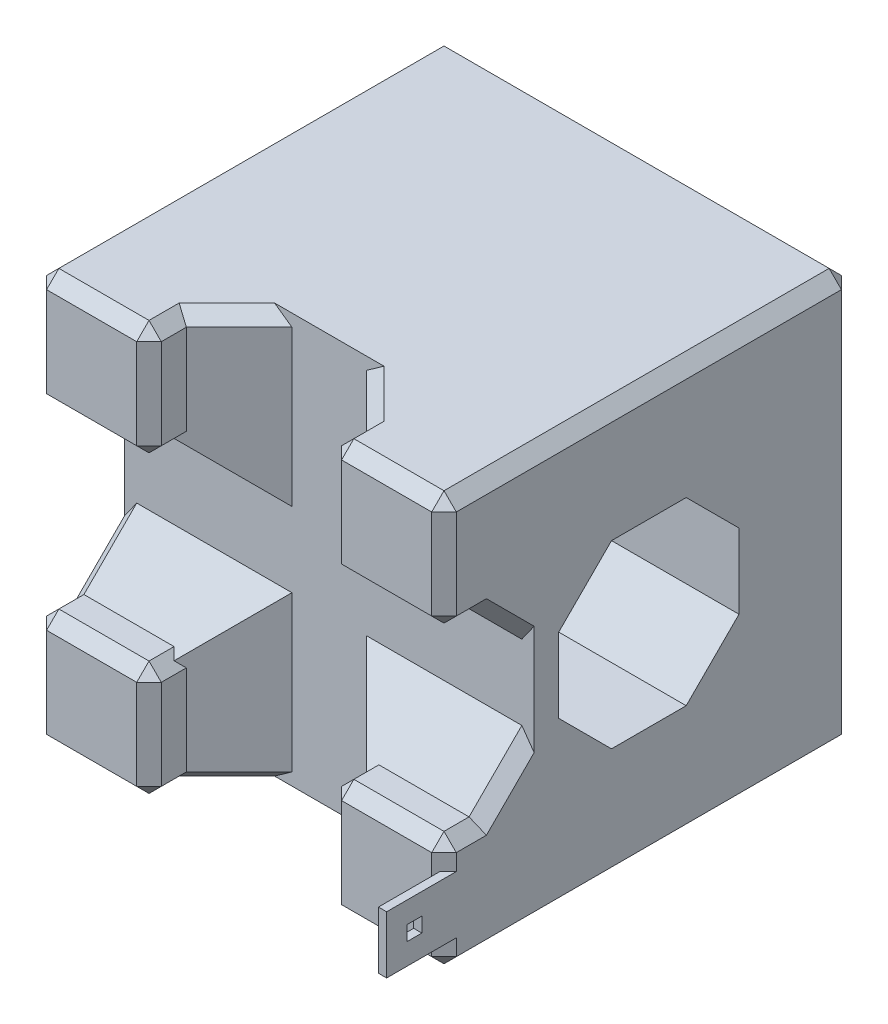
from build123d import *

# Parameters (mm, degrees)
SKETCH1_W                = 50
SKETCH1_H                = 50
BOSS_EXTRUDE1_DEPTH      = 50
CUT_EXTRUDE1_DEPTH       = 87.602540378
CUT_EXTRUDE2_DEPTH       = 87.602540378
CHAMFER1_SIZE            = 1.5
BOSS_EXTRUDE2_DEPTH      = 7
BOSS_EXTRUDE2_DEPTH_BACK = 10
SKETCH4_W                = 1
SKETCH4_H                = 7
SKETCH5_W                = 1.8
SKETCH5_H                = 1.8
CUT_EXTRUDE3_DEPTH       = 7


with BuildPart() as part:
    # Sketch1 → Boss-Extrude1 (new body)
    with BuildSketch(Plane.XY):
        with Locations((25, 25)):
            Rectangle(SKETCH1_W, SKETCH1_H)
    extrude(amount=BOSS_EXTRUDE1_DEPTH)

    # Sketch2 → Cut-Extrude1 (cut, through all)
    with BuildSketch(Plane.ZY):
        Polygon((36, 29.556349186), (29.556349186, 36), (20.443650814, 36), (14, 29.556349186), (14, 20.443650814), (20.443650814, 14), (29.556349186, 14), (36, 20.443650814), align=None)
        Polygon((61, 29.556349186), (54.556349186, 36), (45.443650814, 36), (39, 29.556349186), (39, 20.443650814), (45.443650814, 14), (54.556349186, 14), (61, 20.443650814), align=None)
    extrude(amount=-CUT_EXTRUDE1_DEPTH, mode=Mode.SUBTRACT)

    # Sketch3 → Cut-Extrude2 (cut, through all)
    with BuildSketch(Plane.XZ):
        Polygon((29.556349186, 39), (36, 45.443650814), (36, 54.556349186), (29.556349186, 61), (20.443650814, 61), (14, 54.556349186), (14, 45.443650814), (20.443650814, 39), align=None)
    extrude(amount=-CUT_EXTRUDE2_DEPTH, mode=Mode.SUBTRACT)

    # Chamfer1
    chamfer1_edges = [part.edges().sort_by_distance(p)[0] for p in [
        (50, 7, 50),
        (0, 7, 50),
        (50, 43, 50),
        (7, 36, 50),
        (43, 14, 50),
        (43, 50, 50),
        (50, 14, 47.721825407),
        (50, 36, 47.721825407),
        (0, 14, 47.721825407),
        (0, 36, 47.721825407),
        (0, 32.778174593, 42.221825407),
        (0, 17.221825407, 42.221825407),
        (50, 17.221825407, 42.221825407),
        (50, 32.778174593, 42.221825407),
        (43, 36, 50),
        (36, 36, 47.721825407),
        (14, 36, 47.721825407),
        (7, 14, 50),
        (7, 50, 50),
        (43, 0, 50),
        (36, 0, 47.721825407),
        (14, 0, 47.721825407),
        (17.221825407, 0, 42.221825407),
        (32.778174593, 0, 42.221825407),
        (14, 7, 50),
        (14, 14, 47.721825407),
        (14, 43, 50),
        (14, 50, 47.721825407),
        (36, 14, 47.721825407),
        (36, 7, 50),
        (36, 50, 47.721825407),
        (36, 43, 50),
        (17.221825407, 50, 42.221825407),
        (32.778174593, 50, 42.221825407),
        (0, 43, 50),
        (25, 50, 0),
        (50, 25, 0),
        (25, 0, 0),
        (0, 25, 0),
        (7, 0, 50),
        (0, 50, 25),
        (50, 50, 25),
        (50, 0, 25),
        (0, 0, 25),
    ]]
    chamfer(chamfer1_edges, length=CHAMFER1_SIZE)

    # Sketch4 → Boss-Extrude2 (add, two sides: drawn at the far end of the back side and taken through both)
    with BuildSketch(Plane.XY.offset(50).offset(-BOSS_EXTRUDE2_DEPTH_BACK)):
        with Locations((49.5, 7)):
            Rectangle(SKETCH4_W, SKETCH4_H)
    extrude(amount=BOSS_EXTRUDE2_DEPTH + BOSS_EXTRUDE2_DEPTH_BACK)

    # Sketch5 → Cut-Extrude3 (cut)
    with BuildSketch(Plane(origin=(50, 0, 0), x_dir=(0, 0, -1), z_dir=(1, 0, 0))):
        with Locations((-53.6, 7)):
            Rectangle(SKETCH5_W, SKETCH5_H)
    extrude(amount=-CUT_EXTRUDE3_DEPTH, mode=Mode.SUBTRACT)


solid = part.part
